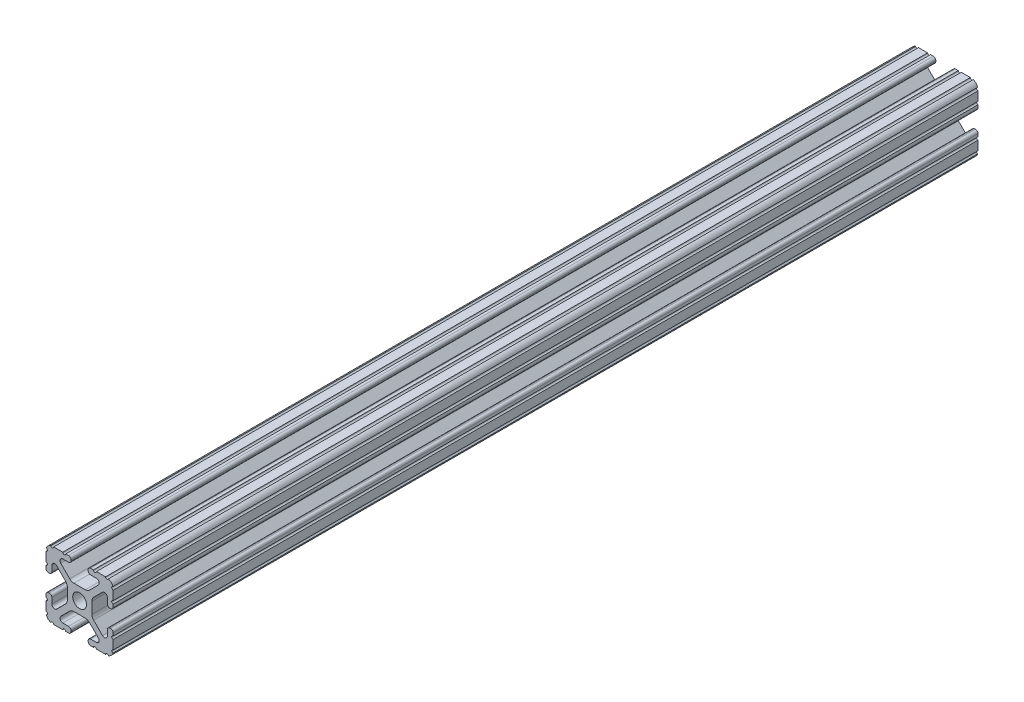
from build123d import *

# Parameters (mm, degrees)
BOSS_EXTRUDE1_START     = -163.5125
BOSS_EXTRUDE1_DEPTH     = 327.025
CUT_EXTRUDE1_DEPTH      = 165.495950273
CUT_EXTRUDE1_DEPTH_BACK = 165.495950273
SKETCH5_R               = 0.55245


with BuildPart() as part:
    # Sketch4 → Boss-Extrude1 (new body)
    with BuildSketch(Plane.XY.offset(BOSS_EXTRUDE1_START)):
        with BuildLine():
            Line((4.190365, -12.7), (10.11729625, -12.7))
            ThreePointArc((10.11729625, -12.7), (11.943543585, -11.943543585), (12.7, -10.11729625))
            Line((12.7, -10.11729625), (12.7, -4.190365))
            ThreePointArc((12.7, -4.190365), (12.42492494, -3.52627506), (11.760835, -3.2512))
            Line((11.760835, -3.2512), (11.429365, -3.2512))
            ThreePointArc((11.429365, -3.2512), (10.76527506, -3.52627506), (10.4902, -4.190365))
            Line((10.4902, -4.190365), (10.4902, -6.348478019))
            ThreePointArc((10.4902, -6.348478019), (9.830707141, -7.335478831), (8.666460301, -7.103895736))
            Line((8.666460301, -7.103895736), (5.299899128, -3.737334563))
            ThreePointArc((5.299899128, -3.737334563), (4.817571085, -3.015479634), (4.6482, -2.16399369))
            Line((4.6482, -2.16399369), (4.6482, 0))
            Line((4.6482, 0), (2.6035, 0))
            ThreePointArc((2.6035, 0), (1.840952505, -1.840952505), (0, -2.6035))
            Line((0, -2.6035), (0, -4.6482))
            Line((0, -4.6482), (2.16399369, -4.6482))
            ThreePointArc((2.16399369, -4.6482), (3.015479634, -4.817571085), (3.737334563, -5.299899128))
            Line((3.737334563, -5.299899128), (7.103895736, -8.666460301))
            ThreePointArc((7.103895736, -8.666460301), (7.335478831, -9.830707141), (6.348478019, -10.4902))
            Line((6.348478019, -10.4902), (4.190365, -10.4902))
            ThreePointArc((4.190365, -10.4902), (3.52627506, -10.76527506), (3.2512, -11.429365))
            Line((3.2512, -11.429365), (3.2512, -11.760835))
            ThreePointArc((3.2512, -11.760835), (3.52627506, -12.42492494), (4.190365, -12.7))
        make_face()
    extrude(amount=BOSS_EXTRUDE1_DEPTH)

    # Sketch5 → Cut-Extrude1 (cut, two sides: drawn at the far end of the back side and taken through both)
    with BuildSketch(Plane.XY.offset(-CUT_EXTRUDE1_DEPTH_BACK)):
        with Locations((10.356153152, -12.7)):
            Circle(SKETCH5_R)
        with Locations((5.796028019, -12.7)):
            Circle(SKETCH5_R)
        with Locations((12.7, -10.356153152)):
            Circle(SKETCH5_R)
        with Locations((12.7, -5.796028019)):
            Circle(SKETCH5_R)
    extrude(amount=CUT_EXTRUDE1_DEPTH + CUT_EXTRUDE1_DEPTH_BACK, mode=Mode.SUBTRACT)

    # Mirror1: part across plane


with BuildPart() as part_1:
    add(part.part)
    add(part.part.mirror(Plane(origin=(0, 0, 0), x_dir=(0, 0, 1), z_dir=(1, 0, 0))))

    # Mirror2: part across plane


with BuildPart() as part_2:
    add(part_1.part)
    add(part_1.part.mirror(Plane.ZX))


solid = part_2.part
